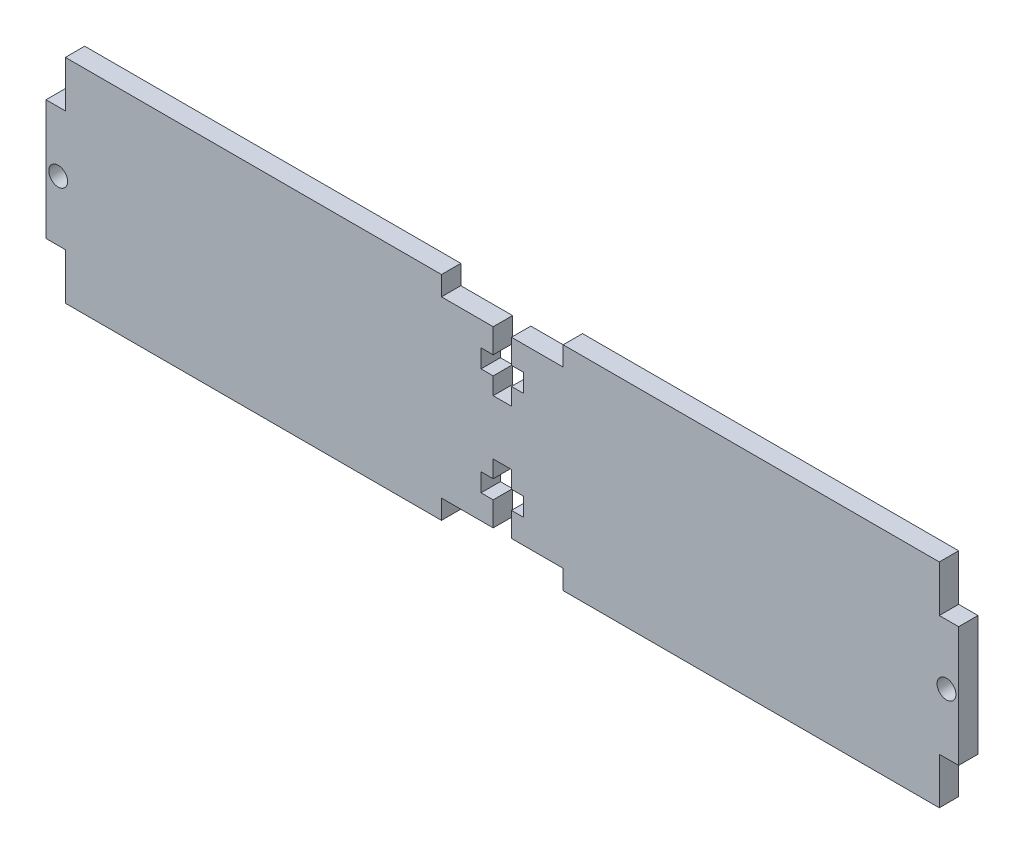
from build123d import *

# Parameters (mm, degrees)
SKETCH1_W           = 150
SKETCH1_H           = 35
BOSS_EXTRUDE1_DEPTH = 3.18
SKETCH2_R           = 1.55
SKETCH2_W           = 3.18
SKETCH2_H           = 7.625
CUT_EXTRUDE1_DEPTH  = 78.080233523


with BuildPart() as part:
    # Sketch1 → Boss-Extrude1 (new body)
    with BuildSketch(Plane.XY):
        Rectangle(SKETCH1_W, SKETCH1_H)
    extrude(amount=BOSS_EXTRUDE1_DEPTH)

    # Sketch2 → Cut-Extrude1 (cut, through all)
    with BuildSketch(Plane.XY.offset(3.18)):
        with Locations((-73, 0)):
            Circle(SKETCH2_R)
        with Locations((73, 0)):
            Circle(SKETCH2_R)
        Polygon((1.5, 14.32), (10, 14.32), (10, 17.5), (-10, 17.5), (-10, 14.32), (-1.5, 14.32), (-1.5, 10.32), (-3.5, 10.32), (-3.5, 7.32), (-1.5, 7.32), (-1.5, 4.5), (1.5, 4.5), (1.5, 7.32), (3.5, 7.32), (3.5, 10.32), (1.5, 10.32), align=None)
        Polygon((-1.5, -7.32), (-1.5, -4.5), (1.5, -4.5), (1.5, -7.32), (3.5, -7.32), (3.5, -10.32), (1.5, -10.32), (1.5, -14.32), (10, -14.32), (10, -17.5), (-10, -17.5), (-10, -14.32), (-1.5, -14.32), (-1.5, -10.32), (-3.5, -10.32), (-3.5, -7.32), align=None)
        with Locations((73.41, -13.6875)):
            Rectangle(SKETCH2_W, SKETCH2_H)
        with Locations((-73.41, 13.6875)):
            Rectangle(SKETCH2_W, SKETCH2_H)
        with Locations((-73.41, -13.6875)):
            Rectangle(SKETCH2_W, SKETCH2_H)
        with Locations((73.41, 13.6875)):
            Rectangle(SKETCH2_W, SKETCH2_H)
    extrude(amount=-CUT_EXTRUDE1_DEPTH, mode=Mode.SUBTRACT)


solid = part.part
